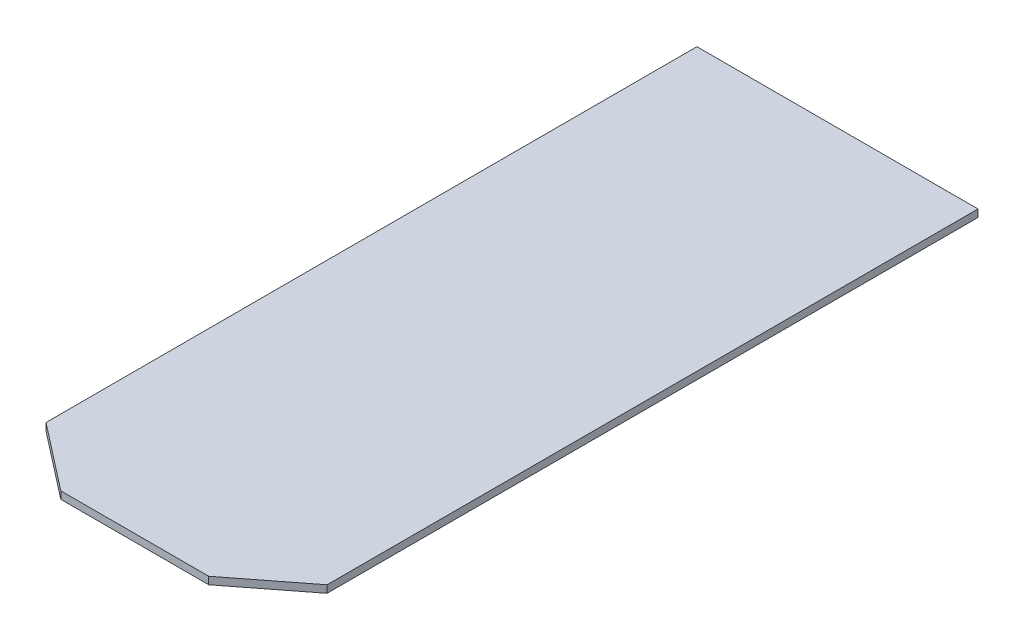
from build123d import *

# Parameters (mm, degrees)
BOSS_EXTRUDE1_DEPTH = 1


with BuildPart() as part:
    # Sketch1 → Boss-Extrude1 (new body)
    with BuildSketch(Plane(origin=(0, 0, 0), x_dir=(1, 0, 0), z_dir=(0, 1, 0))):
        Polygon((-19, -40.5), (-10, -47.5), (10, -47.5), (19, -40.5), (19, 47.5), (-19, 47.5), align=None)
    extrude(amount=BOSS_EXTRUDE1_DEPTH)


solid = part.part
